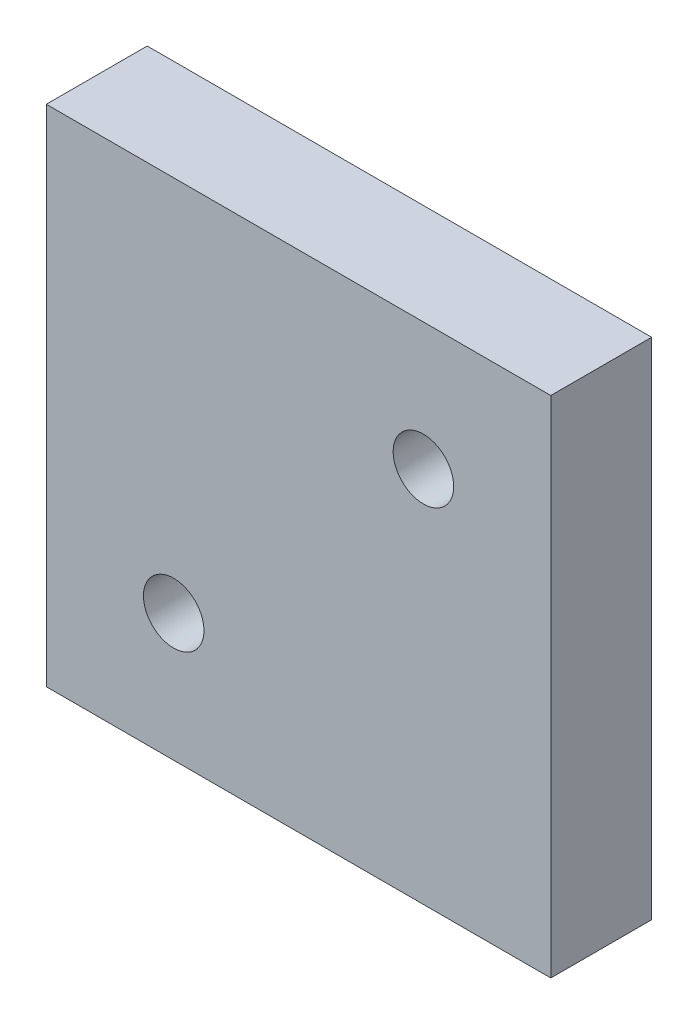
from build123d import *

# Parameters (mm, degrees)
SKETCH_1_W              = 100
SKETCH_1_H              = 100
EXTRUDE_1_DEPTH         = 20
HOLE_WIZARD_12_0_12_1_D = 12


with BuildPart() as part:
    # Эскиз1 → Бобышка-Вытянуть1 (new body)
    with BuildSketch(Plane.XY):
        Rectangle(SKETCH_1_W, SKETCH_1_H)
    extrude(amount=EXTRUDE_1_DEPTH)

    # Диаметр отверстия Ø12.0 (12)1 (through all)
    with Locations(Plane(origin=(0, 0, 0), x_dir=(-1, 0, 0), z_dir=(0, 0, -1))):
        with Locations((-24.748737342, 24.748737342), (24.748737342, -24.748737342)):
            Hole(HOLE_WIZARD_12_0_12_1_D / 2)


solid = part.part
